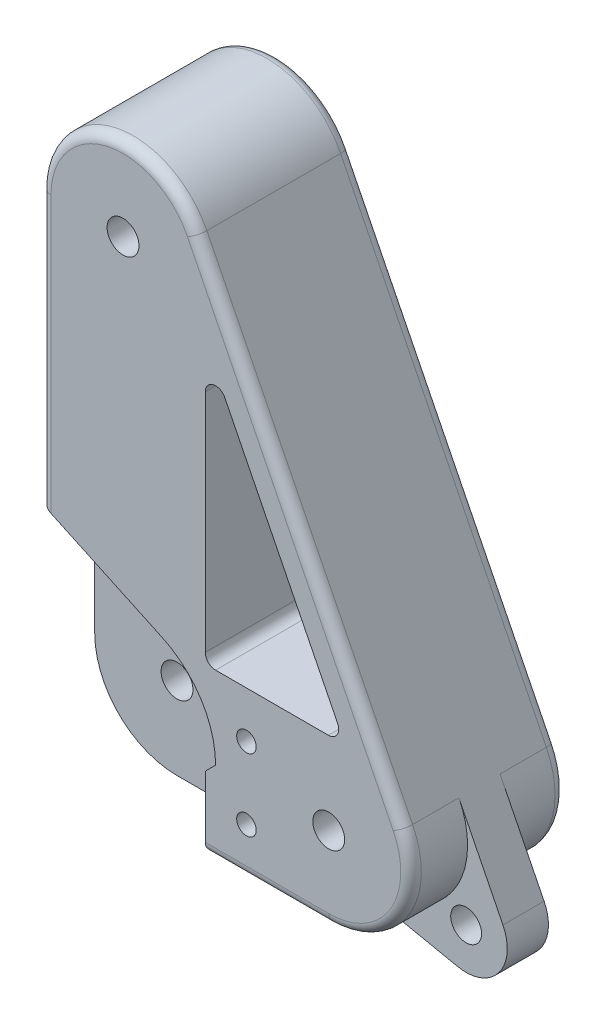
from build123d import *

# Parameters (mm, degrees)
SKETCH1_R                = 1.55
BOSS_EXTRUDE1_DEPTH      = 15
FILLET1_R                = 1
FILLET2_R                = 1
CUT_EXTRUDE1_DEPTH       = 5.25
BOSS_EXTRUDE2_DEPTH      = 2
BOSS_EXTRUDE2_DEPTH_BACK = 2
SKETCH3_R                = 1.5
SKETCH4_R                = 0.95
CUT_EXTRUDE2_DEPTH       = 60.53144322
CUT_EXTRUDE3_DEPTH       = 60.53144322
FILLET3_R                = 1


with BuildPart() as part:
    # Sketch1 → Boss-Extrude1 (new body)
    with BuildSketch(Plane.XY):
        with BuildLine():
            Line((20, -8), (0, -8))
            ThreePointArc((0, -8), (-5.656854249, -5.656854249), (-8, 0))
            Line((-8, 0), (-8, 40))
            ThreePointArc((-8, 40), (-1.838023364, 47.785991916), (7.155417528, 43.577708764))
            Line((7.155417528, 43.577708764), (27.155417528, 3.577708764))
            ThreePointArc((27.155417528, 3.577708764), (26.805206467, -4.205848897), (20, -8))
        make_face()
        Circle(SKETCH1_R, mode=Mode.SUBTRACT)
        with Locations((20, 0)):
            Circle(SKETCH1_R, mode=Mode.SUBTRACT)
        with Locations((0, 40)):
            Circle(SKETCH1_R, mode=Mode.SUBTRACT)
    extrude(amount=BOSS_EXTRUDE1_DEPTH)

    # Fillet1
    fillet1_edges = [part.edges().sort_by_distance(p)[0] for p in [
        (-8, 20, 0),
        (-1.838023364, 47.785991916, 0),
        (17.155417528, 23.577708764, 0),
        (26.805206467, -4.205848897, 0),
        (10, -8, 0),
        (-5.656854249, -5.656854249, 0),
    ]]
    fillet(fillet1_edges, radius=FILLET1_R)

    # Fillet2
    fillet2_edges = [part.edges().sort_by_distance(p)[0] for p in [
        (26.805206467, -4.205848897, 15),
        (17.155417528, 23.577708764, 15),
        (-1.838023364, 47.785991916, 15),
        (-8, 20, 15),
        (-5.656854249, -5.656854249, 15),
        (10, -8, 15),
    ]]
    fillet(fillet2_edges, radius=FILLET2_R)

    # Sketch2 → Cut-Extrude1 (cut)
    with BuildSketch(Plane.XY.offset(15)):
        with BuildLine():
            Line((8, -8), (-8, -8))
            Line((-8, -8), (-8, 13.660862536))
            Line((-8, 13.660862536), (3.803564356, 8.156770083))
            ThreePointArc((3.803564356, 8.156770083), (7.590523012, 4.835696475), (9, 0))
            Line((9, 0), (8, -1))
            Line((8, -1), (8, -8))
        make_face()
    cut_extrude1 = extrude(amount=-CUT_EXTRUDE1_DEPTH, mode=Mode.SUBTRACT)

    # Mirror1: Cut-Extrude1 across plane
    add(cut_extrude1.mirror(Plane.XY.offset(7.5)), mode=Mode.SUBTRACT)

    # Sketch3 → Boss-Extrude2 (add, two sides: drawn at the far end of the back side and taken through both)
    with BuildSketch(Plane.XY.offset(7.5).offset(-BOSS_EXTRUDE2_DEPTH_BACK)):
        with BuildLine():
            Line((31.436659341, -4.984774862), (27.155417528, 3.577708764))
            Line((27.155417528, 3.577708764), (14, -8))
            Line((14, -8), (27.051126316, -10.691207573))
            ThreePointArc((27.051126316, -10.691207573), (31.03052883, -9.211064656), (31.436659341, -4.984774862))
        make_face()
        with Locations((27.858950577, -6.773629244)):
            Circle(SKETCH3_R, mode=Mode.SUBTRACT)
    extrude(amount=BOSS_EXTRUDE2_DEPTH + BOSS_EXTRUDE2_DEPTH_BACK)

    # Sketch4 → Cut-Extrude2 (cut, through all)
    with BuildSketch(Plane(origin=(0, 0, 0), x_dir=(-1, 0, 0), z_dir=(0, 0, -1))):
        with Locations((-12, 3.5)):
            Circle(SKETCH4_R)
        with Locations(Location((-12, -3.5, 0), (0, 0, 180))):
            Circle(SKETCH4_R)
    extrude(amount=-CUT_EXTRUDE2_DEPTH, mode=Mode.SUBTRACT)

    # Sketch5 → Cut-Extrude3 (cut, through all)
    with BuildSketch(Plane(origin=(0, 0, 0), x_dir=(-1, 0, 0), z_dir=(0, 0, -1))):
        with BuildLine():
            Line((-8, 35.180339887), (-8, 8))
            Line((-8, 8), (-20, 8))
            ThreePointArc((-20, 8), (-20.844360125, 7.955316209), (-21.679287946, 7.821763995))
            Line((-21.679287946, 7.821763995), (-8, 35.180339887))
        make_face()
    extrude(amount=-CUT_EXTRUDE3_DEPTH, mode=Mode.SUBTRACT)

    # Fillet3
    fillet3_edges = [part.edges().sort_by_distance(p)[0] for p in [
        (8, 35.180339887, 7.5),
        (8, 8, 7.5),
        (21.679287946, 7.821763995, 7.5),
    ]]
    fillet(fillet3_edges, radius=FILLET3_R)


solid = part.part
